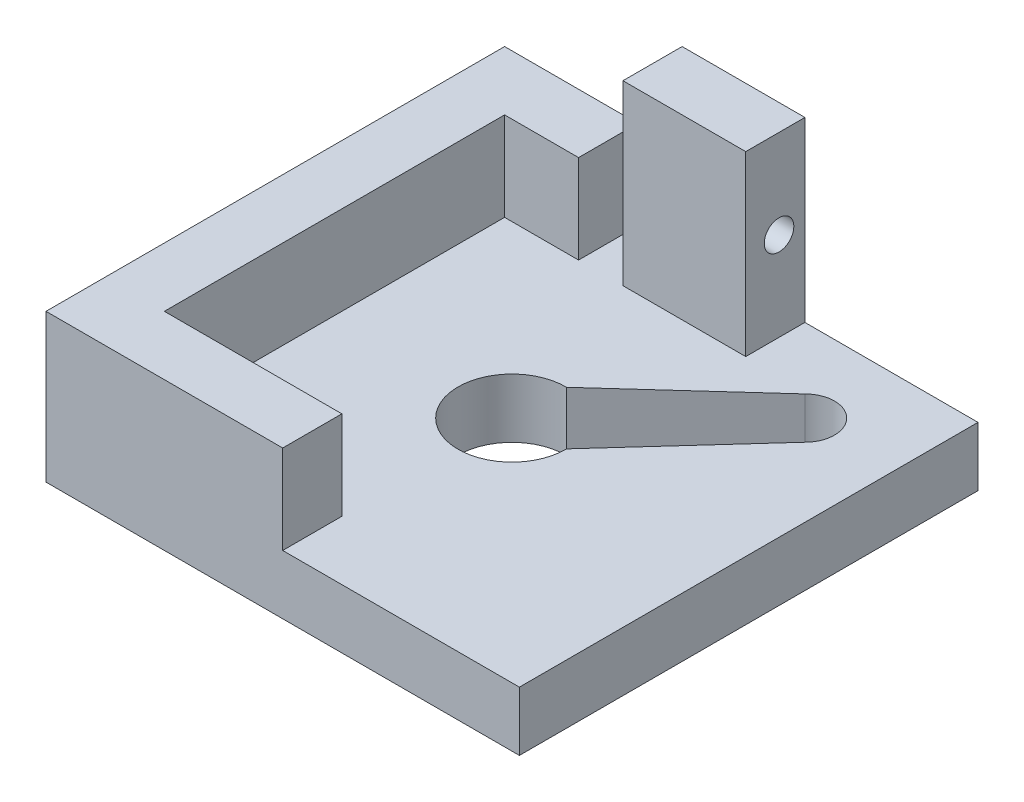
from build123d import *

# Parameters (mm, degrees)
SKETCH1_W           = 32
SKETCH1_H           = 31
BOSS_EXTRUDE1_DEPTH = 4
BOSS_EXTRUDE2_DEPTH = 6
SKETCH5_W           = 8.3
SKETCH5_H           = 4
BOSS_EXTRUDE3_DEPTH = 12
SKETCH6_R           = 1
CUT_EXTRUDE7_DEPTH  = 5
CUT_EXTRUDE6_DEPTH  = 4


with BuildPart() as part:
    # Sketch1 → Boss-Extrude1 (new body)
    with BuildSketch(Plane(origin=(0, 0, 0), x_dir=(1, 0, 0), z_dir=(0, 1, 0))):
        Rectangle(SKETCH1_W, SKETCH1_H)
    extrude(amount=BOSS_EXTRUDE1_DEPTH)

    # Sketch2 → Boss-Extrude2 (add)
    with BuildSketch(Plane(origin=(0, 4, 0), x_dir=(1, 0, 0), z_dir=(0, 1, 0))):
        Polygon((-16, 15.5), (-16, -15.5), (0, -15.5), (0, -11.5), (-12, -11.5), (-12, 11.5), (-7, 11.5), (-7, 15.5), align=None)
    extrude(amount=BOSS_EXTRUDE2_DEPTH)

    # Sketch5 → Boss-Extrude3 (add)
    with BuildSketch(Plane(origin=(0, 4, 0), x_dir=(1, 0, 0), z_dir=(0, 1, 0))):
        with Locations((0.15, 13.5)):
            Rectangle(SKETCH5_W, SKETCH5_H)
    extrude(amount=BOSS_EXTRUDE3_DEPTH)

    # Sketch6 → Cut-Extrude7 (cut)
    with BuildSketch(Plane(origin=(4.3, 0, 0), x_dir=(0, 0, -1), z_dir=(1, 0, 0))):
        with Locations((13.75, 10)):
            Circle(SKETCH6_R)
    extrude(amount=-CUT_EXTRUDE7_DEPTH, mode=Mode.SUBTRACT)

    # Sketch4 → Cut-Extrude6 (cut)
    with BuildSketch(Plane(origin=(0, 4, 0), x_dir=(0.7071067811864886, 0, -0.7071067811866065), z_dir=(0, 1, 0))):
        with BuildLine():
            Line((14, 2), (2.611512971, 2.55))
            ThreePointArc((2.611512971, 2.55), (3.380423224, 1.376676733), (3.65, 0))
            ThreePointArc((3.65, 0), (3.380423224, -1.376676733), (2.611512971, -2.55))
            Line((2.611512971, -2.55), (14, -2))
            ThreePointArc((14, -2), (15.414213562, -1.414213562), (16, 0))
            ThreePointArc((16, 0), (15.414213562, 1.414213562), (14, 2))
        make_face()
        with BuildLine():
            ThreePointArc((3.65, 0), (3.380423224, 1.376676733), (2.611512971, 2.55))
            ThreePointArc((2.611512971, 2.55), (-3.65, 0), (2.611512971, -2.55))
            ThreePointArc((2.611512971, -2.55), (3.380423224, -1.376676733), (3.65, 0))
        make_face()
    extrude(amount=-CUT_EXTRUDE6_DEPTH, mode=Mode.SUBTRACT)


solid = part.part
